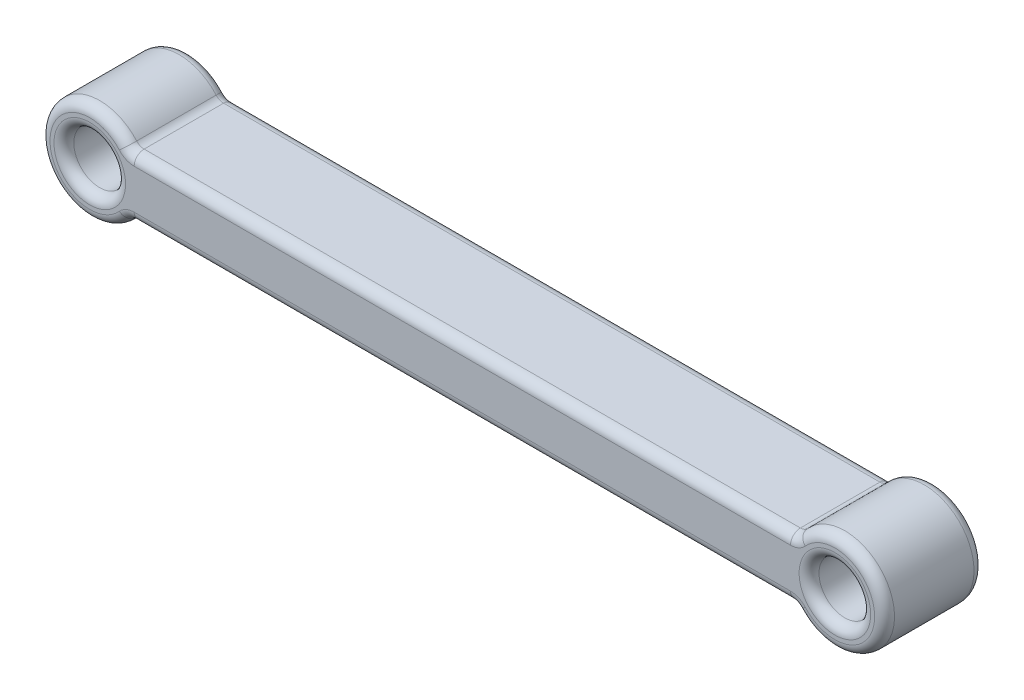
from build123d import *

# Parameters (mm, degrees)
SKETCH1_R           = 2.6
BOSS_EXTRUDE1_DEPTH = 10
FILLET1_R           = 1


with BuildPart() as part:
    # Sketch1 → Boss-Extrude1 (new body)
    with BuildSketch(Plane.XY):
        with BuildLine():
            Line((-71, 3), (-4, 3))
            ThreePointArc((-4, 3), (5, 0), (-4, -3))
            Line((-4, -3), (-71, -3))
            ThreePointArc((-71, -3), (-80, 0), (-71, 3))
        make_face()
        with Locations((-75, 0)):
            Circle(SKETCH1_R, mode=Mode.SUBTRACT)
        Circle(SKETCH1_R, mode=Mode.SUBTRACT)
    extrude(amount=BOSS_EXTRUDE1_DEPTH)

    # Fillet1
    fillet1_edges = [part.edges().sort_by_distance(p)[0] for p in [
        (-77.6, 0, 0),
        (-77.6, 0, 10),
        (5, 0, 10),
        (-2.6, 0, 0),
        (-2.6, 0, 10),
        (-37.5, 3, 10),
        (-80, 0, 10),
        (-37.5, 3, 0),
        (5, 0, 0),
        (-37.5, -3, 0),
        (-80, 0, 0),
        (-71, 3, 5),
        (-4, 3, 5),
        (-4, -3, 5),
        (-71, -3, 5),
        (-37.5, -3, 10),
    ]]
    fillet(fillet1_edges, radius=FILLET1_R)


solid = part.part
